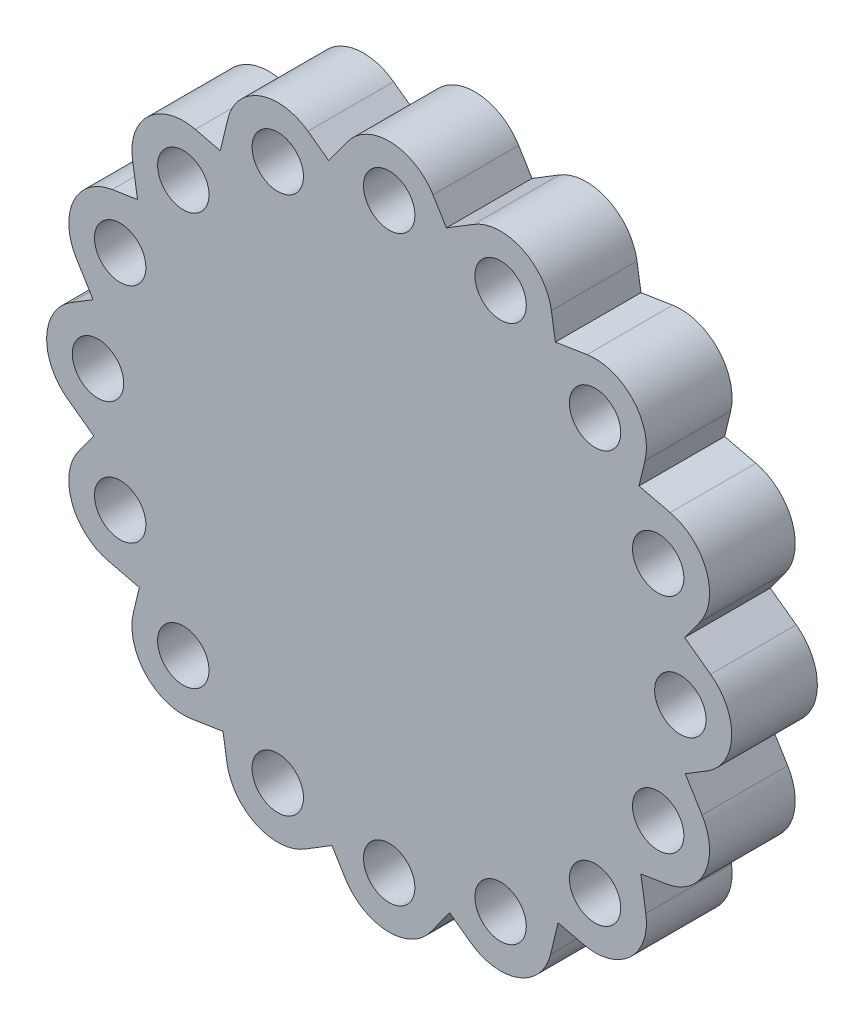
from build123d import *

# Parameters (mm, degrees)
SKETCH1_R           = 1.5
BOSS_EXTRUDE1_DEPTH = 5


with BuildPart() as part:
    # Sketch1 → Boss-Extrude1 (new body)
    with BuildSketch(Plane.XY):
        with BuildLine():
            Line((3.341817931, 17.286797691), (4.939453025, 18.264687321))
            ThreePointArc((4.939453025, 18.264687321), (6.271018689, 18.696765153), (7.653668647, 18.47759065))
            ThreePointArc((7.653668647, 18.47759065), (8.86205197, 17.562621273), (9.468927016, 16.173714546))
            Line((9.468927016, 16.173714546), (9.702808263, 14.692060213))
            Line((9.702808263, 14.692060213), (11.553052787, 14.984123946))
            ThreePointArc((11.553052787, 14.984123946), (12.948608078, 14.873743692), (14.142135624, 14.142135624))
            ThreePointArc((14.142135624, 14.142135624), (14.908392622, 12.834385865), (14.937560462, 11.318962342))
            Line((14.937560462, 11.318962342), (14.586633993, 9.860589752))
            Line((14.586633993, 9.860589752), (16.407804991, 9.422363532))
            ThreePointArc((16.407804991, 9.422363532), (17.654889266, 8.786329586), (18.47759065, 7.653668647))
            ThreePointArc((18.47759065, 7.653668647), (18.685065641, 6.152231554), (18.132085736, 4.741000729))
            Line((18.132085736, 4.741000729), (17.249776925, 3.527933887))
            Line((17.249776925, 3.527933887), (18.764617622, 2.426133683))
            ThreePointArc((18.764617622, 2.426133683), (19.673373605, 1.361276448), (20, 0))
            ThreePointArc((20, 0), (19.617106797, -1.466544242), (18.566165325, -2.558735269))
            Line((18.566165325, -2.558735269), (17.286797691, -3.341817931))
            Line((17.286797691, -3.341817931), (18.264687321, -4.939453025))
            ThreePointArc((18.264687321, -4.939453025), (18.696765153, -6.271018689), (18.47759065, -7.653668647))
            ThreePointArc((18.47759065, -7.653668647), (17.562621273, -8.86205197), (16.173714546, -9.468927016))
            Line((16.173714546, -9.468927016), (14.692060213, -9.702808263))
            Line((14.692060213, -9.702808263), (14.984123946, -11.553052787))
            ThreePointArc((14.984123946, -11.553052787), (14.873743692, -12.948608078), (14.142135624, -14.142135624))
            ThreePointArc((14.142135624, -14.142135624), (12.834385865, -14.908392622), (11.318962342, -14.937560462))
            Line((11.318962342, -14.937560462), (9.860589752, -14.586633993))
            Line((9.860589752, -14.586633993), (9.422363532, -16.407804991))
            ThreePointArc((9.422363532, -16.407804991), (8.786329586, -17.654889266), (7.653668647, -18.47759065))
            ThreePointArc((7.653668647, -18.47759065), (6.152231554, -18.685065641), (4.741000729, -18.132085736))
            Line((4.741000729, -18.132085736), (3.527933887, -17.249776925))
            Line((3.527933887, -17.249776925), (2.426133683, -18.764617622))
            ThreePointArc((2.426133683, -18.764617622), (1.361276448, -19.673373605), (0, -20))
            ThreePointArc((0, -20), (-1.466544242, -19.617106797), (-2.558735269, -18.566165325))
            Line((-2.558735269, -18.566165325), (-3.341817931, -17.286797691))
            Line((-3.341817931, -17.286797691), (-4.939453025, -18.264687321))
            ThreePointArc((-4.939453025, -18.264687321), (-6.271018689, -18.696765153), (-7.653668647, -18.47759065))
            ThreePointArc((-7.653668647, -18.47759065), (-8.86205197, -17.562621273), (-9.468927016, -16.173714546))
            Line((-9.468927016, -16.173714546), (-9.702808263, -14.692060213))
            Line((-9.702808263, -14.692060213), (-11.553052787, -14.984123946))
            ThreePointArc((-11.553052787, -14.984123946), (-12.948608078, -14.873743692), (-14.142135624, -14.142135624))
            ThreePointArc((-14.142135624, -14.142135624), (-14.908392622, -12.834385865), (-14.937560462, -11.318962342))
            Line((-14.937560462, -11.318962342), (-14.586633993, -9.860589752))
            Line((-14.586633993, -9.860589752), (-16.407804991, -9.422363532))
            ThreePointArc((-16.407804991, -9.422363532), (-17.654889266, -8.786329586), (-18.47759065, -7.653668647))
            ThreePointArc((-18.47759065, -7.653668647), (-18.685065641, -6.152231554), (-18.132085736, -4.741000729))
            Line((-18.132085736, -4.741000729), (-17.249776925, -3.527933887))
            Line((-17.249776925, -3.527933887), (-18.764617622, -2.426133683))
            ThreePointArc((-18.764617622, -2.426133683), (-19.673373605, -1.361276448), (-20, 0))
            ThreePointArc((-20, 0), (-19.617106797, 1.466544242), (-18.566165325, 2.558735269))
            Line((-18.566165325, 2.558735269), (-17.286797691, 3.341817931))
            Line((-17.286797691, 3.341817931), (-18.264687321, 4.939453025))
            ThreePointArc((-18.264687321, 4.939453025), (-18.696765153, 6.271018689), (-18.47759065, 7.653668647))
            ThreePointArc((-18.47759065, 7.653668647), (-17.562621273, 8.86205197), (-16.173714546, 9.468927016))
            Line((-16.173714546, 9.468927016), (-14.692060213, 9.702808263))
            Line((-14.692060213, 9.702808263), (-14.984123946, 11.553052787))
            ThreePointArc((-14.984123946, 11.553052787), (-14.873743692, 12.948608078), (-14.142135624, 14.142135624))
            ThreePointArc((-14.142135624, 14.142135624), (-12.834385865, 14.908392622), (-11.318962342, 14.937560462))
            Line((-11.318962342, 14.937560462), (-9.860589752, 14.586633993))
            Line((-9.860589752, 14.586633993), (-9.422363532, 16.407804991))
            ThreePointArc((-9.422363532, 16.407804991), (-8.786329586, 17.654889266), (-7.653668647, 18.47759065))
            ThreePointArc((-7.653668647, 18.47759065), (-6.152231554, 18.685065641), (-4.741000729, 18.132085736))
            Line((-4.741000729, 18.132085736), (-3.527933887, 17.249776925))
            Line((-3.527933887, 17.249776925), (-2.426133683, 18.764617622))
            ThreePointArc((-2.426133683, 18.764617622), (-1.361276448, 19.673373605), (0, 20))
            ThreePointArc((0, 20), (1.466544242, 19.617106797), (2.558735269, 18.566165325))
            Line((2.558735269, 18.566165325), (3.341817931, 17.286797691))
        make_face()
        with Locations((0, 17)):
            Circle(SKETCH1_R, mode=Mode.SUBTRACT)
        with Locations((6.50561835, 15.705952053)):
            Circle(SKETCH1_R, mode=Mode.SUBTRACT)
        with Locations((12.02081528, 12.02081528)):
            Circle(SKETCH1_R, mode=Mode.SUBTRACT)
        with Locations((15.705952053, 6.50561835)):
            Circle(SKETCH1_R, mode=Mode.SUBTRACT)
        with Locations((17, 0)):
            Circle(SKETCH1_R, mode=Mode.SUBTRACT)
        with Locations((15.705952053, -6.50561835)):
            Circle(SKETCH1_R, mode=Mode.SUBTRACT)
        with Locations((12.02081528, -12.02081528)):
            Circle(SKETCH1_R, mode=Mode.SUBTRACT)
        with Locations((6.50561835, -15.705952053)):
            Circle(SKETCH1_R, mode=Mode.SUBTRACT)
        with Locations((0, -17)):
            Circle(SKETCH1_R, mode=Mode.SUBTRACT)
        with Locations((-6.50561835, -15.705952053)):
            Circle(SKETCH1_R, mode=Mode.SUBTRACT)
        with Locations((-12.02081528, -12.02081528)):
            Circle(SKETCH1_R, mode=Mode.SUBTRACT)
        with Locations((-15.705952053, -6.50561835)):
            Circle(SKETCH1_R, mode=Mode.SUBTRACT)
        with Locations((-17, 0)):
            Circle(SKETCH1_R, mode=Mode.SUBTRACT)
        with Locations((-15.705952053, 6.50561835)):
            Circle(SKETCH1_R, mode=Mode.SUBTRACT)
        with Locations((-12.02081528, 12.02081528)):
            Circle(SKETCH1_R, mode=Mode.SUBTRACT)
        with Locations((-6.50561835, 15.705952053)):
            Circle(SKETCH1_R, mode=Mode.SUBTRACT)
    extrude(amount=BOSS_EXTRUDE1_DEPTH)


solid = part.part
